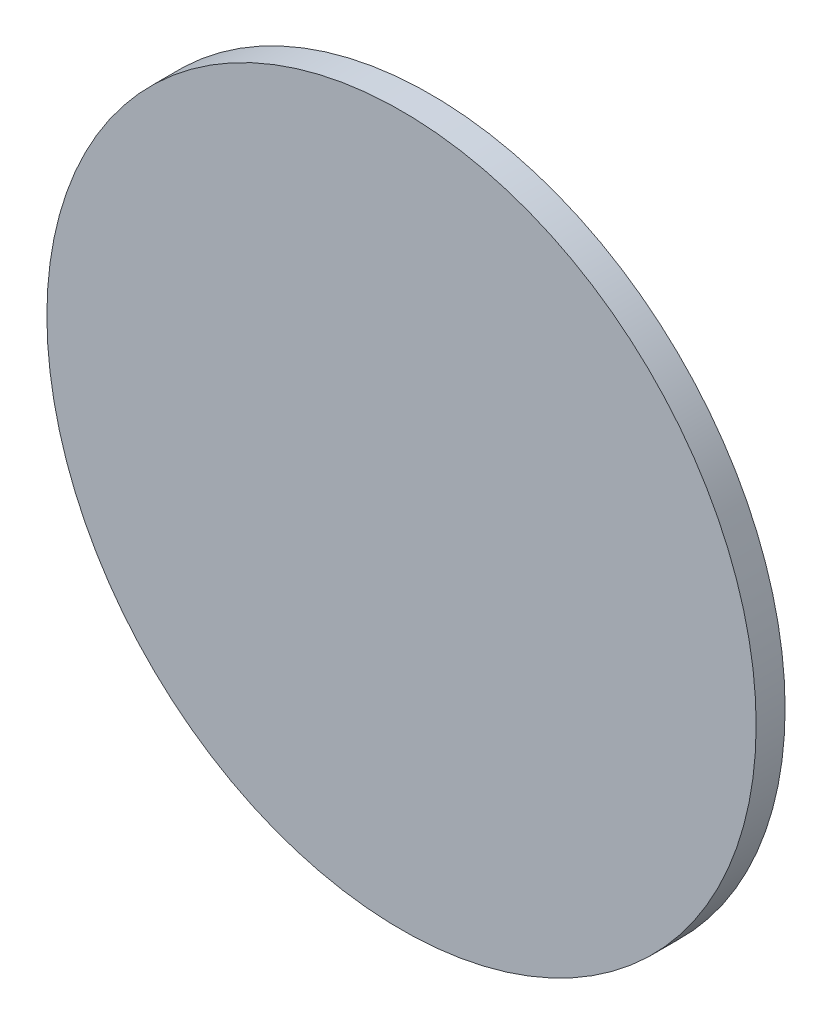
from build123d import *

# Parameters (mm, degrees)
SKETCH1_R           = 122.5
BOSS_EXTRUDE1_DEPTH = 10


with BuildPart() as part:
    # Sketch1 → Boss-Extrude1 (new body)
    with BuildSketch(Plane.XY):
        Circle(SKETCH1_R)
    extrude(amount=BOSS_EXTRUDE1_DEPTH)


solid = part.part
